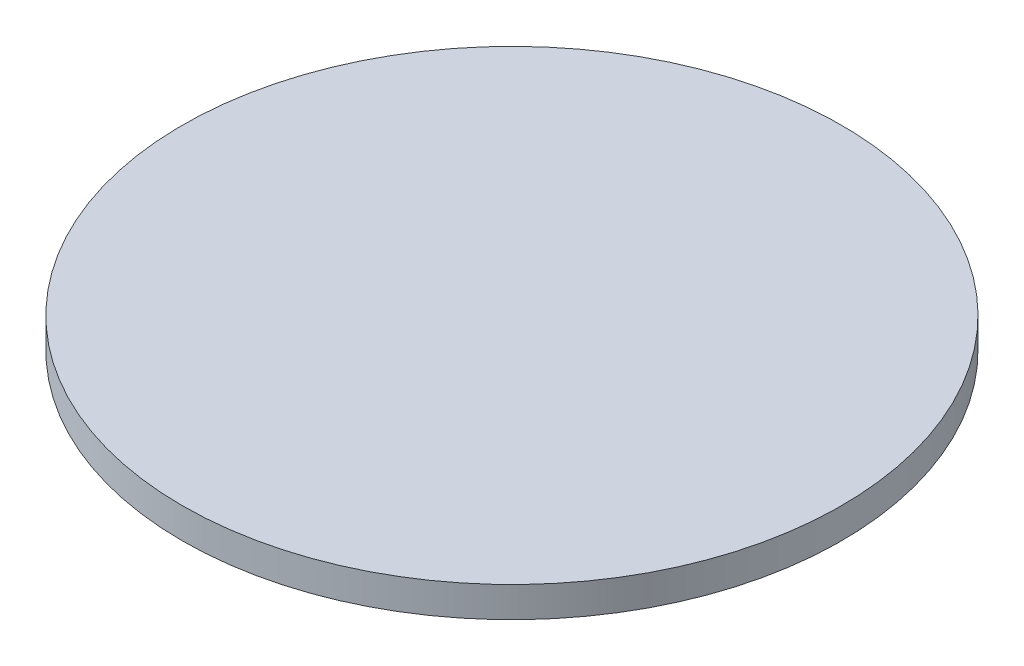
from build123d import *

# Parameters (mm, degrees)
SKETCH1_R           = 2.7
BOSS_EXTRUDE1_DEPTH = 10
BOSS_EXTRUDE1_DRAFT = -55
CUT_EXTRUDE1_REACH  = 28.014
SKETCH2_R           = 16.981480067
SKETCH2_R_2         = 15


with BuildPart() as part:
    # Sketch1 → Boss-Extrude1 (with draft: the straight prism first)
    with BuildSketch(Plane(origin=(0, 0, 0), x_dir=(1, 0, 0), z_dir=(0, 1, 0))):
        Circle(SKETCH1_R)
    extrude(amount=BOSS_EXTRUDE1_DEPTH)
    # Boss-Extrude1: the draft: its side faces are tilted about the plane it starts from
    boss_extrude1_sides = [part.faces().sort_by_distance(p)[0] for p in [
        (-2.7, 5, 0),
    ]]
    draft(boss_extrude1_sides, Plane(origin=(0, 0, 0), x_dir=(1, 0, 0), z_dir=(0, 1, 0)), BOSS_EXTRUDE1_DRAFT)

    # Cut-Extrude1: up to this cone (the profile starts inside it)
    cut_extrude1_end = Plane(origin=(0, 10, 0), z_dir=(0, 1, 0)).offset(-11.890559353) * Cone(1.428e-06, 81.955759241, 57.386039421, align=(Align.CENTER, Align.CENTER, Align.MIN), mode=Mode.PRIVATE)
    # Sketch2 → Cut-Extrude1 (cut, up to the surface)
    with BuildSketch(Plane(origin=(0, 10, 0), x_dir=(1, 0, 0), z_dir=(0, 1, 0)), mode=Mode.PRIVATE) as cut_extrude1_sk1:
        Circle(SKETCH2_R)
        with Locations(Location((0, 0, 0), (0, 0, 270))):
            Circle(SKETCH2_R_2, mode=Mode.SUBTRACT)
    cut_extrude1_tool1 = extrude(cut_extrude1_sk1.sketch, amount=-CUT_EXTRUDE1_REACH, mode=Mode.PRIVATE) & cut_extrude1_end
    add(cut_extrude1_tool1.solids().sort_by_distance((-16.501171, 10, 0))[0], mode=Mode.SUBTRACT)


solid = part.part
